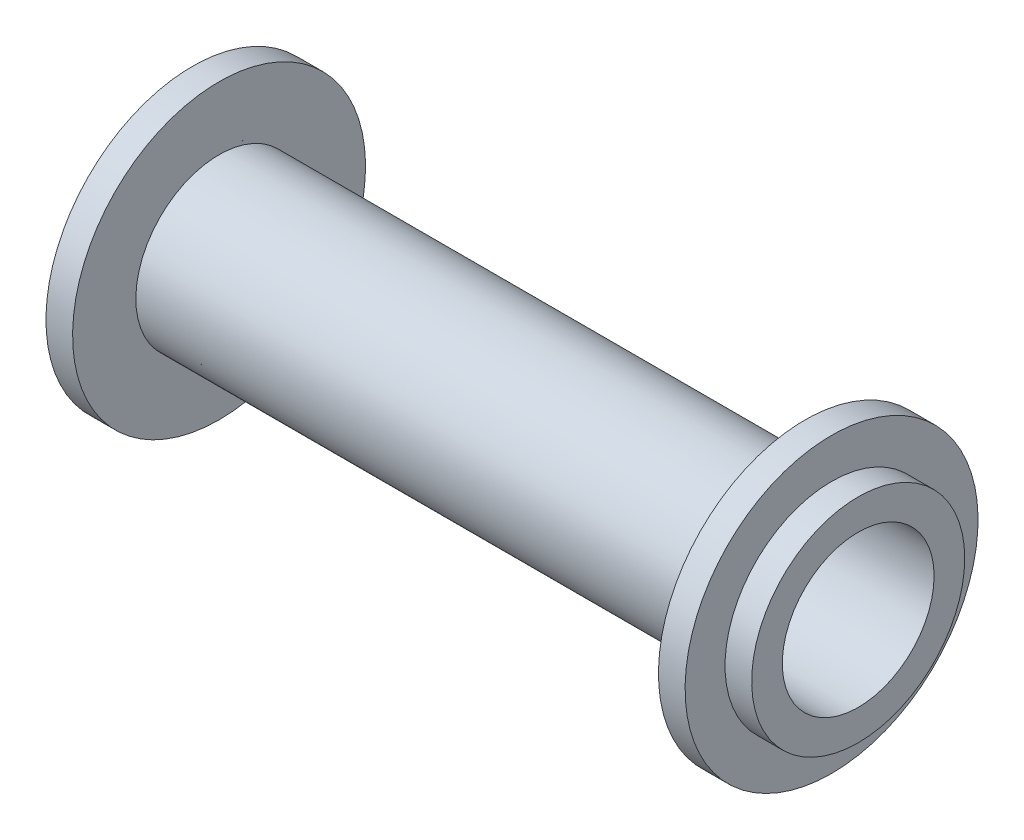
from build123d import *

# Parameters (mm, degrees)
SKETCH2_R           = 5.7
CUT_EXTRUDE1_DEPTH  = 51.457903246
BOSS_EXTRUDE1_START = 2
SKETCH3_R           = 8
SKETCH3_R_2         = 5.7
BOSS_EXTRUDE1_DEPTH = 2
SKETCH4_R           = 8
SKETCH4_R_2         = 5.7
BOSS_EXTRUDE2_DEPTH = 2


with BuildPart() as part:
    # Sketch1 → Revolve1 (revolve)
    with BuildSketch(Plane.XY, mode=Mode.PRIVATE) as revolve1_sk:
        Polygon((-24, 0), (24, 0), (24, 11), (22, 11), (22, 6.25), (-22, 6.25), (-22, 11), (-24, 11), align=None)
    revolve(revolve1_sk.sketch.rotate(Axis((-24, 0, 0), (1, 0, 0)), 180), axis=Axis((-24, 0, 0), (1, 0, 0)))

    # Sketch2 → Cut-Extrude1 (cut, through all)
    with BuildSketch(Plane(origin=(24, 0, 0), x_dir=(0, 0, -1), z_dir=(1, 0, 0))):
        Circle(SKETCH2_R)
    extrude(amount=-CUT_EXTRUDE1_DEPTH, mode=Mode.SUBTRACT)

    # Sketch3 → Boss-Extrude1 (add)
    with BuildSketch(Plane(origin=(24, 0, 0), x_dir=(0, 0, -1), z_dir=(1, 0, 0)).offset(BOSS_EXTRUDE1_START)):
        with Locations(Location((0, 0, 0), (0, 0, 270))):
            Circle(SKETCH3_R)
        Circle(SKETCH3_R_2, mode=Mode.SUBTRACT)
    extrude(amount=-BOSS_EXTRUDE1_DEPTH)

    # Sketch4 → Boss-Extrude2 (add)
    with BuildSketch(Plane.ZY.offset(24)):
        with Locations(Location((0, 0, 0), (0, 0, 270))):
            Circle(SKETCH4_R)
        with Locations(Location((0, 0, 0), (0, 0, 180))):
            Circle(SKETCH4_R_2, mode=Mode.SUBTRACT)
    extrude(amount=BOSS_EXTRUDE2_DEPTH)


solid = part.part
